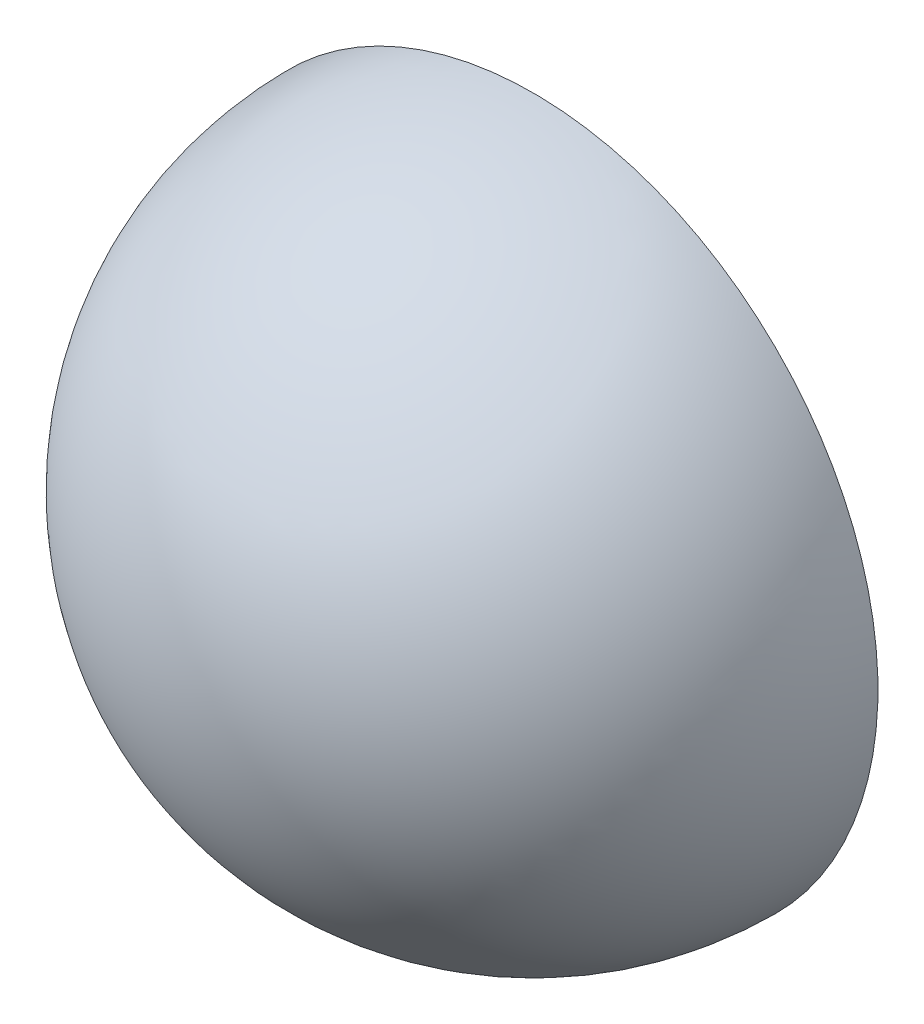
from build123d import *

# Parameters (mm, degrees)
REVOLVE_6_ANGLE = 180


with BuildPart() as part:
    # ｽｹｯﾁ1 → 回転6 (revolve)
    with BuildSketch(Plane.XY):
        with BuildLine():
            Line((-13.65, 0), (13.65, 0))
            ThreePointArc((13.65, 0), (0, 13.65), (-13.65, 0))
        make_face()
    revolve(axis=Axis((-13.65, 0, 0), (1, 0, 0)), revolution_arc=REVOLVE_6_ANGLE)


solid = part.part
